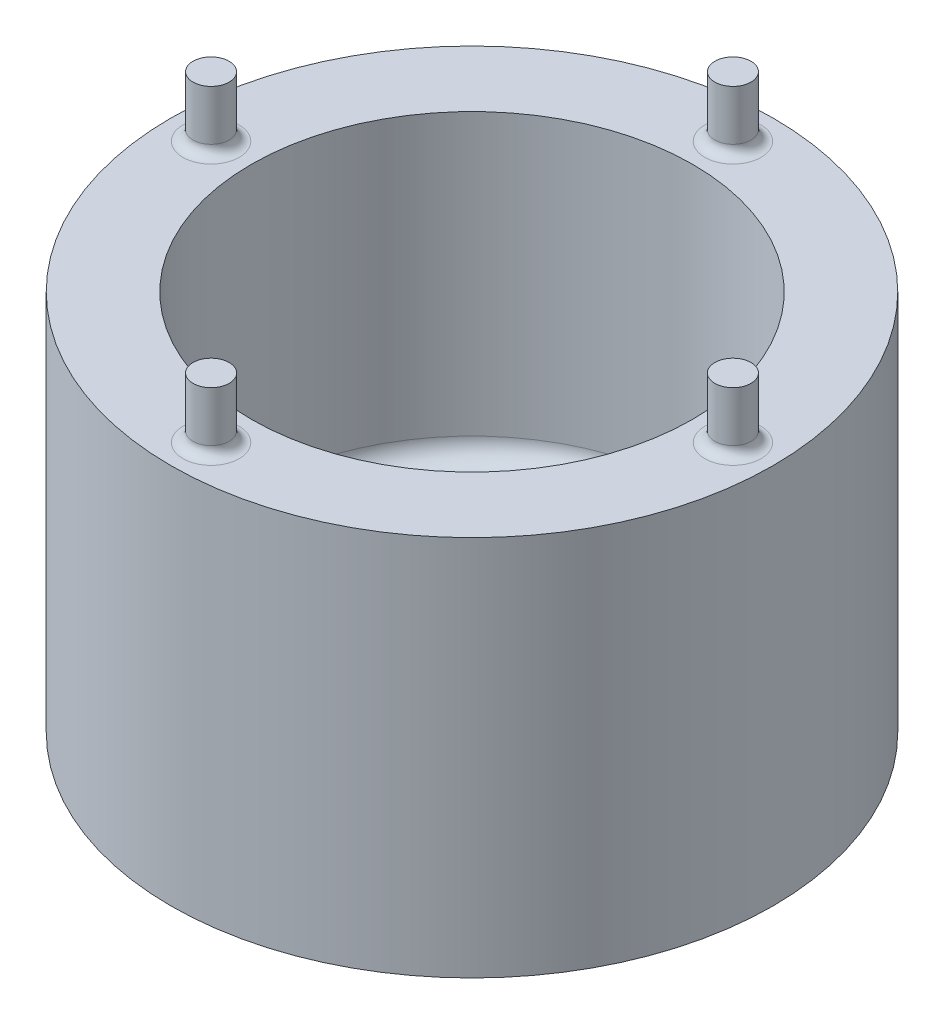
from build123d import *

# Parameters (mm, degrees)
SKETCH1_R                = 15
BOSS_EXTRUDE1_DEPTH      = 4
SKETCH2_R                = 15
SKETCH2_R_2              = 11
BOSS_EXTRUDE2_DEPTH      = 15
SKETCH3_R                = 0.9
BOSS_EXTRUDE3_DEPTH      = 3
FILLET1_R                = 0.5
CIRPATTERN1_COUNT        = 4
FILLET1_OF_CIRPATTERN1_R = 0.5
FILLET2_R                = 1


with BuildPart() as part:
    # Sketch1 → Boss-Extrude1 (new body)
    with BuildSketch(Plane(origin=(0, 0, 0), x_dir=(1, 0, 0), z_dir=(0, 1, 0))):
        with Locations(Location((0, 0, 0), (0, 0, 270))):
            Circle(SKETCH1_R)
    extrude(amount=BOSS_EXTRUDE1_DEPTH)

    # Sketch2 → Boss-Extrude2 (add)
    with BuildSketch(Plane(origin=(0, 4, 0), x_dir=(1, 0, 0), z_dir=(0, 1, 0))):
        with Locations(Location((0, 0, 0), (0, 0, 270))):
            Circle(SKETCH2_R)
        with Locations(Location((0, 0, 0), (0, 0, 270))):
            Circle(SKETCH2_R_2, mode=Mode.SUBTRACT)
    extrude(amount=BOSS_EXTRUDE2_DEPTH)

    # Sketch3 → Boss-Extrude3 (add)
    with BuildSketch(Plane(origin=(0, 19, 0), x_dir=(1, 0, 0), z_dir=(0, 1, 0))):
        with Locations(Location((0, -13, 0), (0, 0, 270))):
            Circle(SKETCH3_R)
    boss_extrude3 = extrude(amount=BOSS_EXTRUDE3_DEPTH)

    # Fillet1
    fillet1_edges = [part.edges().sort_by_distance(p)[0] for p in [
        (0, 19, 12.1),
    ]]
    fillet(fillet1_edges, radius=FILLET1_R)

    # CirPattern1: Boss-Extrude3 ×4 about axis
    cirpattern1_axis = Axis((0, 0, 0), (0, 1, 0))
    for i in range(1, CIRPATTERN1_COUNT):
        add(boss_extrude3.rotate(cirpattern1_axis, i * 360 / CIRPATTERN1_COUNT))

    # Fillet1 of CirPattern1
    fillet1_of_cirpattern1_edges = [part.edges().sort_by_distance(p)[0] for p in [
        (12.1, 19, 0),
        (0, 19, -12.1),
        (-12.1, 19, 0),
    ]]
    fillet(fillet1_of_cirpattern1_edges, radius=FILLET1_OF_CIRPATTERN1_R)

    # Fillet2
    fillet2_edges = [part.edges().sort_by_distance(p)[0] for p in [
        (0, 4, -11),
    ]]
    fillet(fillet2_edges, radius=FILLET2_R)


solid = part.part
